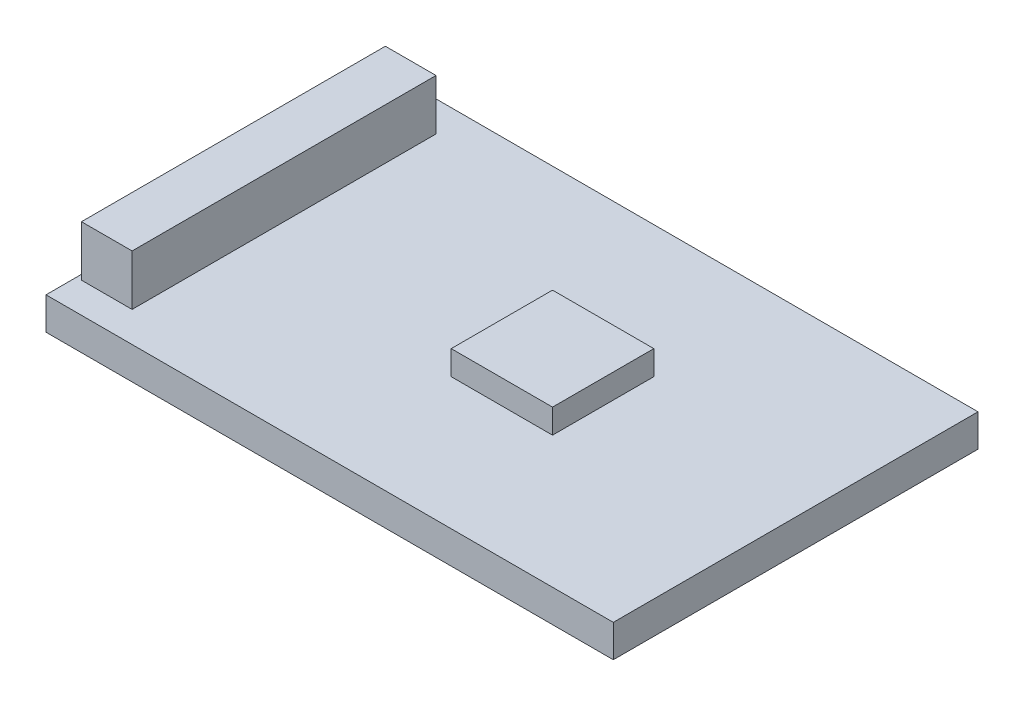
from build123d import *

# Parameters (mm, degrees)
SKETCH1_W          = 28
SKETCH1_H          = 18
PCB_DEPTH          = 1.6
ADS1115_CHIP_START = 1.6
SKETCH2_W          = 5
SKETCH2_H          = 5
ADS1115_CHIP_DEPTH = 1.2
HEADER_START       = 1.6
SKETCH3_W          = 2.5
SKETCH3_H          = 15
HEADER_DEPTH       = 2.5


with BuildPart() as part:
    # Sketch1 → PCB (new body)
    with BuildSketch(Plane(origin=(0, 0, 0), x_dir=(1, 0, 0), z_dir=(0, 1, 0))):
        Rectangle(SKETCH1_W, SKETCH1_H)
    extrude(amount=PCB_DEPTH)

    # Sketch2 → ADS1115_Chip (add)
    with BuildSketch(Plane(origin=(0, 0, 0), x_dir=(1, 0, 0), z_dir=(0, 1, 0)).offset(ADS1115_CHIP_START)):
        with Locations((2, 0)):
            Rectangle(SKETCH2_W, SKETCH2_H)
    extrude(amount=ADS1115_CHIP_DEPTH)

    # Sketch3 → Header (add)
    with BuildSketch(Plane(origin=(0, 0, 0), x_dir=(1, 0, 0), z_dir=(0, 1, 0)).offset(HEADER_START)):
        with Locations((-12.5, 0)):
            Rectangle(SKETCH3_W, SKETCH3_H)
    extrude(amount=HEADER_DEPTH)


solid = part.part
